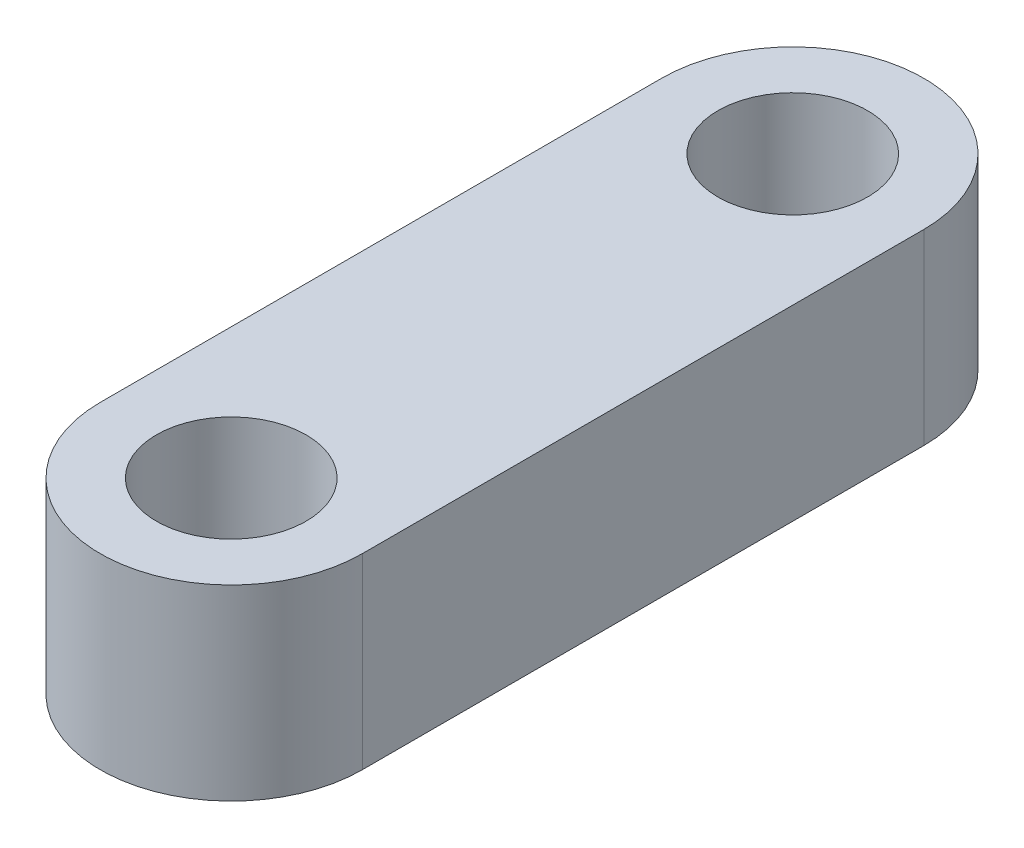
from build123d import *

# Parameters (mm, degrees)
SKETCH1_R           = 2
BOSS_EXTRUDE1_DEPTH = 5


with BuildPart() as part:
    # Sketch1 → Boss-Extrude1 (new body)
    with BuildSketch(Plane(origin=(0, 0, 0), x_dir=(1, 0, 0), z_dir=(0, 1, 0))):
        with BuildLine():
            Line((18.5, -42.073164809), (18.5, -57.073164809))
            ThreePointArc((18.5, -57.073164809), (15, -60.573164809), (11.5, -57.073164809))
            Line((11.5, -57.073164809), (11.5, -42.073164809))
            ThreePointArc((11.5, -42.073164809), (15, -38.573164809), (18.5, -42.073164809))
        make_face()
        with Locations(Location((15, -42.073164809, 0), (0, 0, 270))):
            Circle(SKETCH1_R, mode=Mode.SUBTRACT)
        with Locations(Location((15, -57.073164809, 0), (0, 0, 90))):
            Circle(SKETCH1_R, mode=Mode.SUBTRACT)
    extrude(amount=BOSS_EXTRUDE1_DEPTH)


solid = part.part
